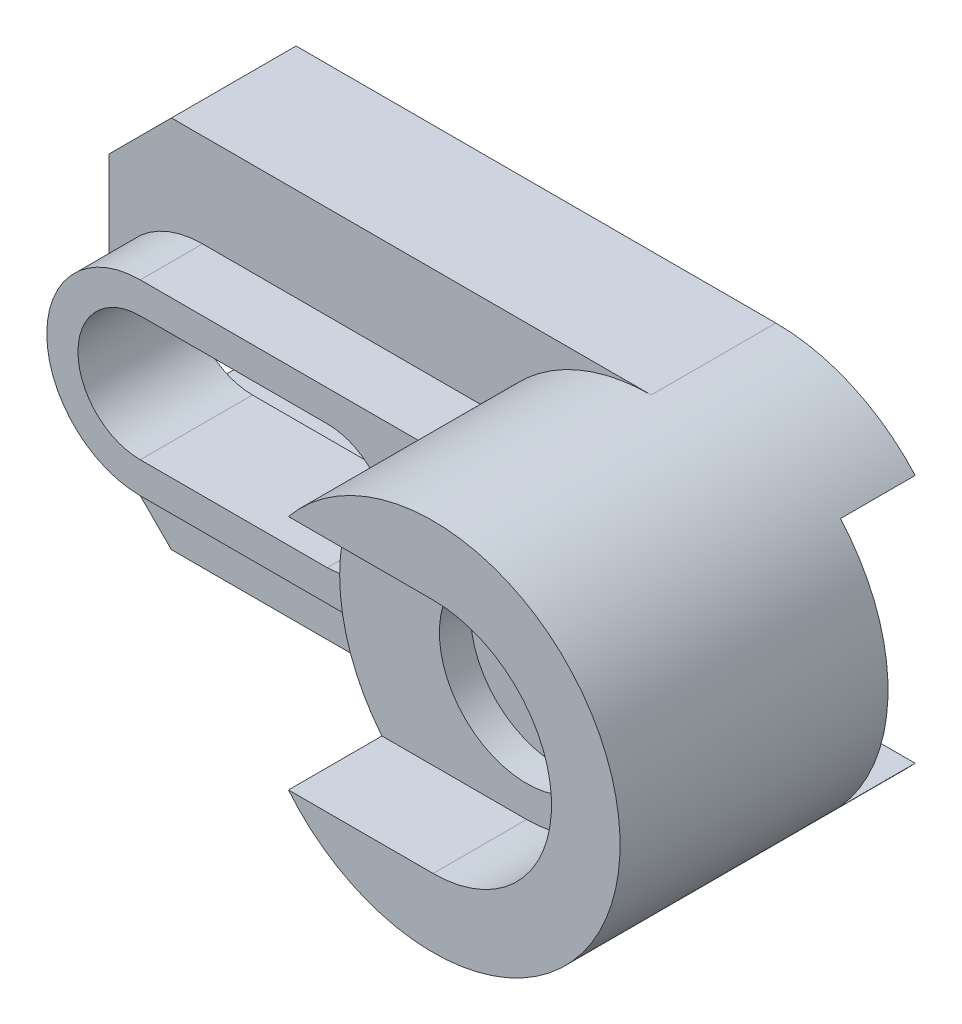
from build123d import *

# Parameters (mm, degrees)
ESBO_O3_R                = 30
RESSALTO_EXTRUS_O1_DEPTH = 55
RESSALTO_EXTRUS_O2_START = -20
RESSALTO_EXTRUS_O2_DEPTH = 20
CORTE_EXTRUS_O2_DEPTH    = 15
ESBO_O9_R                = 14
CORTE_EXTRUS_O6_DEPTH    = 5
ESBO_O12_R               = 6
CORTE_EXTRUS_O7_DEPTH    = 65
CHANFRO2_SIZE            = 10
CHANFRO3_SIZE            = 10
RESSALTO_EXTRUS_O4_START = 10
RESSALTO_EXTRUS_O4_DEPTH = 10
CORTE_EXTRUS_O8_DEPTH    = 54
ESBO_O16_W               = 12
ESBO_O16_H               = 40
CORTE_EXTRUS_O9_DEPTH    = 124


with BuildPart() as part:
    # Esboço3 → Ressalto-extrusão1 (new body)
    with BuildSketch(Plane.XY):
        Circle(ESBO_O3_R)
    extrude(amount=-RESSALTO_EXTRUS_O1_DEPTH)

    # Esboço4 → Ressalto-extrusão2 (add)
    with BuildSketch(Plane(origin=(0, 0, -55), x_dir=(-1, 0, 0), z_dir=(0, 0, -1)).offset(RESSALTO_EXTRUS_O2_START)):
        with BuildLine():
            Line((0, 30), (87, 30))
            Line((87, 30), (87, -30))
            Line((87, -30), (0, -30))
            ThreePointArc((0, -30), (30, 0), (0, 30))
        make_face()
    extrude(amount=RESSALTO_EXTRUS_O2_DEPTH)

    # Esboço6 → Corte-extrusão2 (cut)
    with BuildSketch(Plane.XY):
        with BuildLine():
            Line((0, -19), (-43.25121435, -19))
            Line((-43.25121435, -19), (-43.25121435, 19))
            Line((-43.25121435, 19), (0, 19))
            ThreePointArc((0, 19), (19, 0), (0, -19))
        make_face()
    extrude(amount=-CORTE_EXTRUS_O2_DEPTH, mode=Mode.SUBTRACT)

    # Esboço9 → Corte-extrusão6 (cut)
    with BuildSketch(Plane.XY.offset(-15)):
        Circle(ESBO_O9_R)
    extrude(amount=-CORTE_EXTRUS_O6_DEPTH, mode=Mode.SUBTRACT)

    # Esboço12 → Corte-extrusão7 (cut)
    with BuildSketch(Plane.XY.offset(-20)):
        with Locations((0.167448048, 0.04248466)):
            Circle(ESBO_O12_R)
    extrude(amount=-CORTE_EXTRUS_O7_DEPTH, mode=Mode.SUBTRACT)

    # Chanfro2
    chanfro2_edges = [part.edges().sort_by_distance(p)[0] for p in [
        (-87, 30, -45),
    ]]
    chamfer(chanfro2_edges, length=CHANFRO2_SIZE)

    # Chanfro3
    chanfro3_edges = [part.edges().sort_by_distance(p)[0] for p in [
        (-87, -30, -45),
    ]]
    chamfer(chanfro3_edges, length=CHANFRO3_SIZE)

    # Esboço14 → Ressalto-extrusão4 (add)
    with BuildSketch(Plane.XY.offset(-35).offset(RESSALTO_EXTRUS_O4_START)):
        with BuildLine():
            Line((-72, 15), (-25.980762114, 15))
            ThreePointArc((-25.980762114, 15), (-30, 0), (-25.980762114, -15))
            Line((-25.980762114, -15), (-72, -15))
            ThreePointArc((-72, -15), (-87, 0), (-72, 15))
        make_face()
    extrude(amount=-RESSALTO_EXTRUS_O4_DEPTH)

    # Esboço15 → Corte-extrusão8 (cut)
    with BuildSketch(Plane.XY.offset(-25)):
        with BuildLine():
            Line((-72, 10), (-42, 10))
            ThreePointArc((-42, 10), (-32, 0), (-42, -10))
            Line((-42, -10), (-72, -10))
            ThreePointArc((-72, -10), (-82, 0), (-72, 10))
        make_face()
    extrude(amount=-CORTE_EXTRUS_O8_DEPTH, mode=Mode.SUBTRACT)

    # Esboço16 → Corte-extrusão9 (cut)
    with BuildSketch(Plane.ZY.offset(87)):
        with Locations((-49, 0)):
            Rectangle(ESBO_O16_W, ESBO_O16_H)
    extrude(amount=-CORTE_EXTRUS_O9_DEPTH, mode=Mode.SUBTRACT)


solid = part.part
